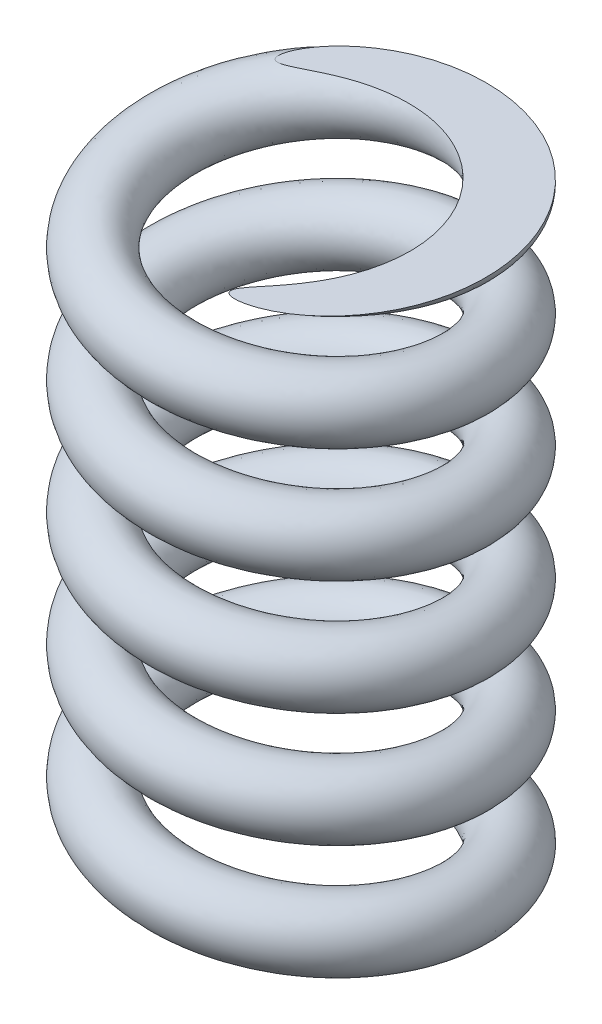
from build123d import *

# Parameters (mm, degrees)
SWEEP_5_PITCH            = 3.5
SWEEP_5_HEIGHT           = 19
SWEEP_5_RADIUS           = 4.5
SWEEP_5_START_ANGLE      = -180
SWEEP_5_PROFILE_R        = 1
CUT_EXTRUDE_2_DEPTH      = 22.45220749
CUT_EXTRUDE_2_DEPTH_BACK = 22.45220749
SKETCH_89_W              = 69.978044934
SKETCH_89_H              = 31.950273618
SKETCH_89_W_2            = 46.999315539
SKETCH_89_H_2            = 18


with BuildPart() as part:
    # По траектории5: sweep along a helix
    with BuildLine() as sweep_5_path:
        add(Helix(SWEEP_5_PITCH, SWEEP_5_HEIGHT, SWEEP_5_RADIUS, center=(0, 0, 0), direction=(0, 1, 0), lefthand=True, mode=Mode.PRIVATE).rotate(Axis((0, 0, 0), (0, 1, 0)), SWEEP_5_START_ANGLE))
    # По траектории5 profile (on start of the path) → По траектории5 (sweep)
    with BuildSketch(Plane(origin=(0, 0, -4.5), x_dir=(-0.1228495283034499, 0.9924253087238454, 0), z_dir=(0.9924253087238454, 0.1228495283034499, 2.6143115904598e-13))):
        Circle(SWEEP_5_PROFILE_R)
    sweep(path=sweep_5_path.line, is_frenet=True)

    # Эскиз89 → Вырез-Вытянуть2 (cut, two sides: drawn at the far end of the back side and taken through both)
    with BuildSketch(Plane.XY.offset(-CUT_EXTRUDE_2_DEPTH_BACK)):
        with Locations((-2.820856745, 8.728772448)):
            Rectangle(SKETCH_89_W, SKETCH_89_H)
        with Locations((-5.338677221, 9)):
            Rectangle(SKETCH_89_W_2, SKETCH_89_H_2, mode=Mode.SUBTRACT)
    extrude(amount=CUT_EXTRUDE_2_DEPTH + CUT_EXTRUDE_2_DEPTH_BACK, mode=Mode.SUBTRACT)


solid = part.part
